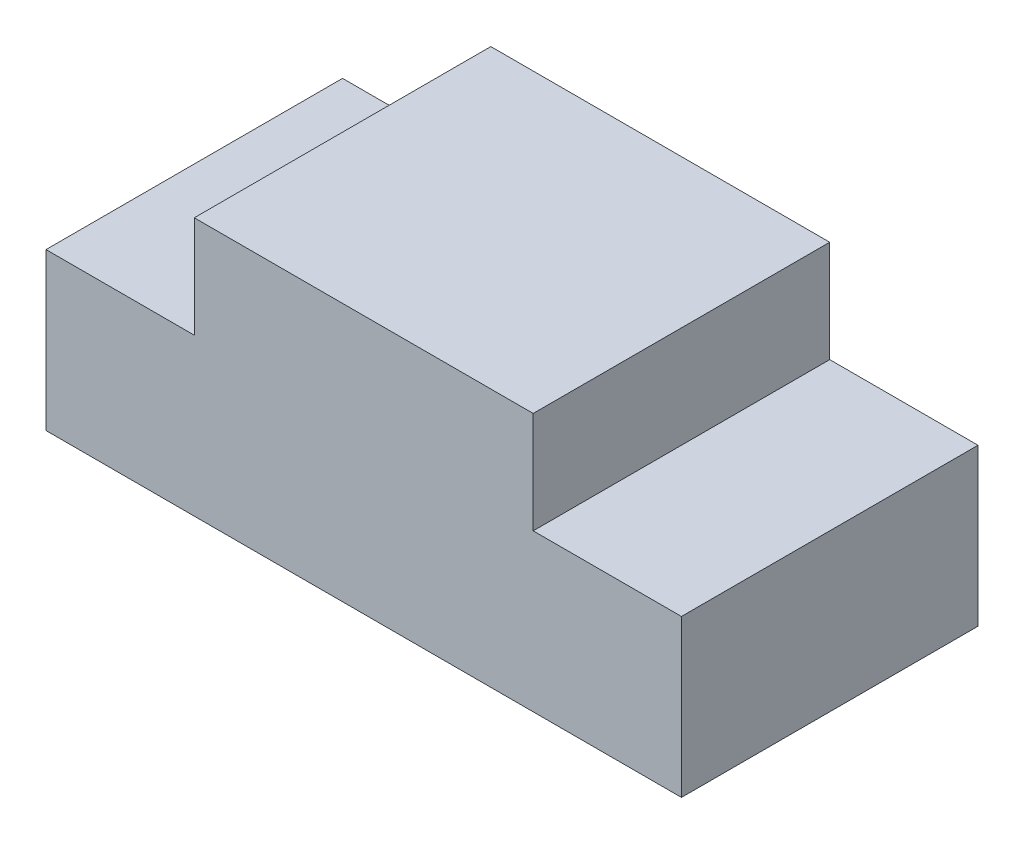
from build123d import *

# Parameters (mm, degrees)
SKETCH1_W           = 150
SKETCH1_H           = 36
BOSS_EXTRUDE1_DEPTH = 70
SKETCH3_W           = 148
SKETCH3_H           = 68
CUT_EXTRUDE1_DEPTH  = 111.180351821
SKETCH4_W           = 35
SKETCH4_H           = 70
BOSS_EXTRUDE3_DEPTH = 1
SKETCH5_W           = 80
SKETCH5_H           = 25
BOSS_EXTRUDE4_DEPTH = 70
SKETCH6_W           = 78
SKETCH6_H           = 68
CUT_EXTRUDE2_DEPTH  = 24


with BuildPart() as part:
    # Sketch1 → Boss-Extrude1 (new body)
    with BuildSketch(Plane.XY):
        with Locations((2.095459837, 17.011641444)):
            Rectangle(SKETCH1_W, SKETCH1_H)
    extrude(amount=BOSS_EXTRUDE1_DEPTH)

    # Sketch3 → Cut-Extrude1 (cut, through all)
    with BuildSketch(Plane(origin=(0, 35.011641444, 0), x_dir=(1, 0, 0), z_dir=(0, 1, 0))):
        with Locations((2.095459837, -35)):
            Rectangle(SKETCH3_W, SKETCH3_H)
    extrude(amount=-CUT_EXTRUDE1_DEPTH, mode=Mode.SUBTRACT)

    # Sketch4 → Boss-Extrude3 (add)
    with BuildSketch(Plane(origin=(0, 35.011641444, 0), x_dir=(1, 0, 0), z_dir=(0, 1, 0))):
        with Locations((59.595459837, -35)):
            Rectangle(SKETCH4_W, SKETCH4_H)
        with Locations((-55.404540163, -35)):
            Rectangle(SKETCH4_W, SKETCH4_H)
    extrude(amount=BOSS_EXTRUDE3_DEPTH)

    # Sketch5 → Boss-Extrude4 (add)
    with BuildSketch(Plane(origin=(0, 0, 0), x_dir=(-1, 0, 0), z_dir=(0, 0, -1))):
        with Locations((-2.095459837, 47.511641444)):
            Rectangle(SKETCH5_W, SKETCH5_H)
    extrude(amount=-BOSS_EXTRUDE4_DEPTH)

    # Sketch6 → Cut-Extrude2 (cut)
    with BuildSketch(Plane.XZ.offset(-35.011641444)):
        with Locations((2.095459837, 35)):
            Rectangle(SKETCH6_W, SKETCH6_H)
    extrude(amount=-CUT_EXTRUDE2_DEPTH, mode=Mode.SUBTRACT)


solid = part.part
